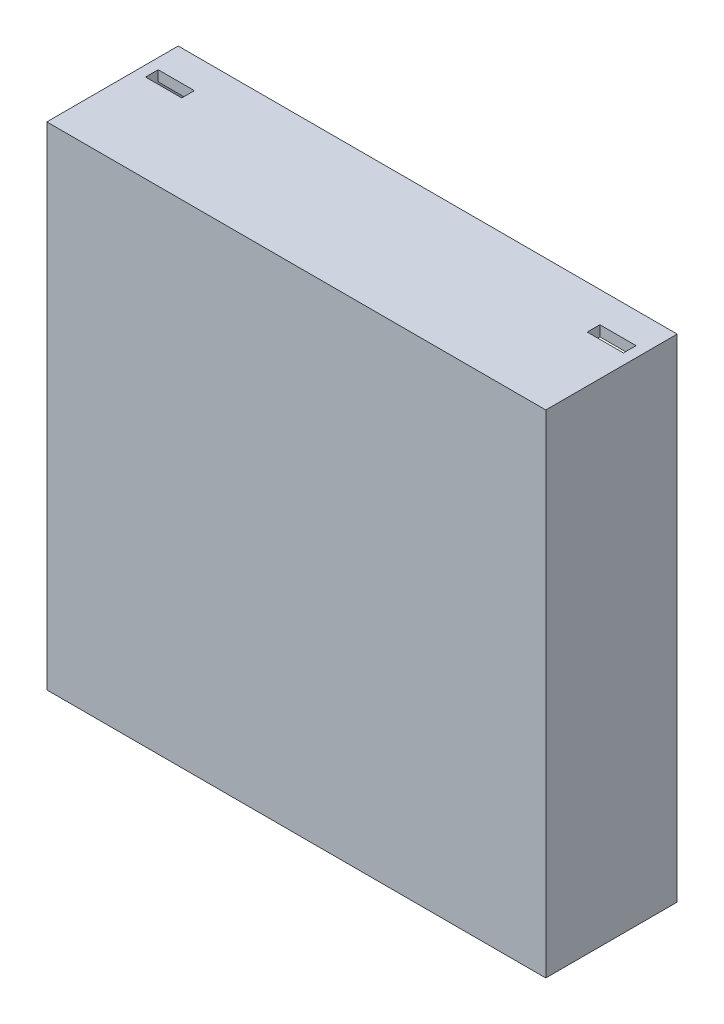
from build123d import *

# Parameters (mm, degrees)
SKETCH1_W               = 71
SKETCH1_H               = 70
SKETCH1_W_2             = 68
SKETCH1_H_2             = 67
BOSS_EXTRUDE1_DEPTH     = 17.2
BOSS_EXTRUDE2_START     = 17.2
SKETCH1_2_W             = 71
SKETCH1_2_H             = 70
BOSS_EXTRUDE2_DEPTH     = 1.5
CUT_EXTRUDE1_REACH      = 96.232
SKETCH6_W               = 5.15
SKETCH6_H               = 1.8
MIRROR2_COPY_1_REACH    = 96.232
MIRROR2_COPY_1_SKETCH_W = 5.15
MIRROR2_COPY_1_SKETCH_H = 1.8
CUT_EXTRUDE2_REACH      = 96.978
SKETCH7_W               = 9.92
SKETCH7_H               = 21.65
SKETCH8_R               = 2.15
SKETCH8_R_2             = 0.4
SKETCH8_W               = 1.5
SKETCH8_H               = 1.5
BOSS_EXTRUDE6_DEPTH     = 5.7


with BuildPart() as part:
    # Sketch1 → Boss-Extrude1 (new body)
    with BuildSketch(Plane.XY):
        with Locations((-24.75, 25.25)):
            Rectangle(SKETCH1_W, SKETCH1_H)
        with Locations((-24.75, 25.25)):
            Rectangle(SKETCH1_W_2, SKETCH1_H_2, mode=Mode.SUBTRACT)
    extrude(amount=BOSS_EXTRUDE1_DEPTH)

    # Sketch1<2> → Boss-Extrude2 (add)
    with BuildSketch(Plane.XY.offset(BOSS_EXTRUDE2_START)):
        with Locations((-24.75, 25.25)):
            Rectangle(SKETCH1_2_W, SKETCH1_2_H)
    extrude(amount=BOSS_EXTRUDE2_DEPTH)

    # Sketch6 → Cut-Extrude1 (cut, up to next)
    with BuildSketch(Plane(origin=(0, 60.25, 0), x_dir=(1, 0, 0), z_dir=(0, 1, 0)), mode=Mode.PRIVATE) as cut_extrude1_sk1:
        with Locations((6.675, -5.25)):
            Rectangle(SKETCH6_W, SKETCH6_H)
    cut_extrude1_tool1 = extrude(cut_extrude1_sk1.sketch, amount=-CUT_EXTRUDE1_REACH, mode=Mode.PRIVATE) & part.part
    cut_extrude1 = cut_extrude1_tool1.solids().sort_by_distance((6.675, 60.25, 5.25))[0]
    add(cut_extrude1, mode=Mode.SUBTRACT)

    # Mirror1: Cut-Extrude1 across plane
    add(cut_extrude1.mirror(Plane(origin=(-24.75, 0, 0), x_dir=(0, 0, 1), z_dir=(1, 0, 0))), mode=Mode.SUBTRACT)

    # Mirror2: Cut-Extrude1 across plane
    add(cut_extrude1.mirror(Plane.ZX.offset(25.25)), mode=Mode.SUBTRACT)

    # Mirror2 copy 1 sketch → Mirror2 copy 1 (cut, up to next)
    with BuildSketch(Plane(origin=(-49.5, -9.75, 0), x_dir=(-1, 0, 0), z_dir=(0, -1, 0)), mode=Mode.PRIVATE) as mirror2_copy_1_sk1:
        with Locations((6.675, -5.25)):
            Rectangle(MIRROR2_COPY_1_SKETCH_W, MIRROR2_COPY_1_SKETCH_H)
    mirror2_copy_1_tool1 = extrude(mirror2_copy_1_sk1.sketch, amount=-MIRROR2_COPY_1_REACH, mode=Mode.PRIVATE) & part.part
    add(mirror2_copy_1_tool1.solids().sort_by_distance((-56.175, -9.75, 5.25))[0], mode=Mode.SUBTRACT)

    # Sketch7 → Cut-Extrude2 (cut, up to next)
    with BuildSketch(Plane.ZY.offset(60.25), mode=Mode.PRIVATE) as cut_extrude2_sk1:
        with Locations((6.74, 22.95)):
            Rectangle(SKETCH7_W, SKETCH7_H)
    cut_extrude2_tool1 = extrude(cut_extrude2_sk1.sketch, amount=-CUT_EXTRUDE2_REACH, mode=Mode.PRIVATE) & part.part
    add(cut_extrude2_tool1.solids().sort_by_distance((-60.25, 22.95, 6.74))[0], mode=Mode.SUBTRACT)

    # Sketch8 → Boss-Extrude6 (add)
    # profile 1 of 4: a face of its own
    with BuildSketch(Plane(origin=(0, 0, 17.2), x_dir=(-1, 0, 0), z_dir=(0, 0, -1))):
        with Locations((51.65, 49.525)):
            Circle(SKETCH8_R)
        with Locations((51.65, 49.525)):
            Circle(SKETCH8_R_2, mode=Mode.SUBTRACT)
    # profile 2 of 4: a face of its own
    with BuildSketch(Plane(origin=(0, 0, 17.2), x_dir=(-1, 0, 0), z_dir=(0, 0, -1))):
        with Locations((-2.3, 49.625)):
            Circle(SKETCH8_R)
        with Locations((-2.3, 49.625)):
            Circle(SKETCH8_R_2, mode=Mode.SUBTRACT)
    # profile 3 of 4: a face of its own
    with BuildSketch(Plane(origin=(0, 0, 17.2), x_dir=(-1, 0, 0), z_dir=(0, 0, -1))):
        with Locations((-1.95, 1.075)):
            Circle(SKETCH8_R)
        with Locations((-1.95, 1.075)):
            Circle(SKETCH8_R_2, mode=Mode.SUBTRACT)
    # profile 4 of 4: a face of its own
    with BuildSketch(Plane(origin=(0, 0, 17.2), x_dir=(-1, 0, 0), z_dir=(0, 0, -1))):
        with Locations((53, -0.125)):
            Rectangle(SKETCH8_W, SKETCH8_H)
    extrude(amount=BOSS_EXTRUDE6_DEPTH)


solid = part.part
